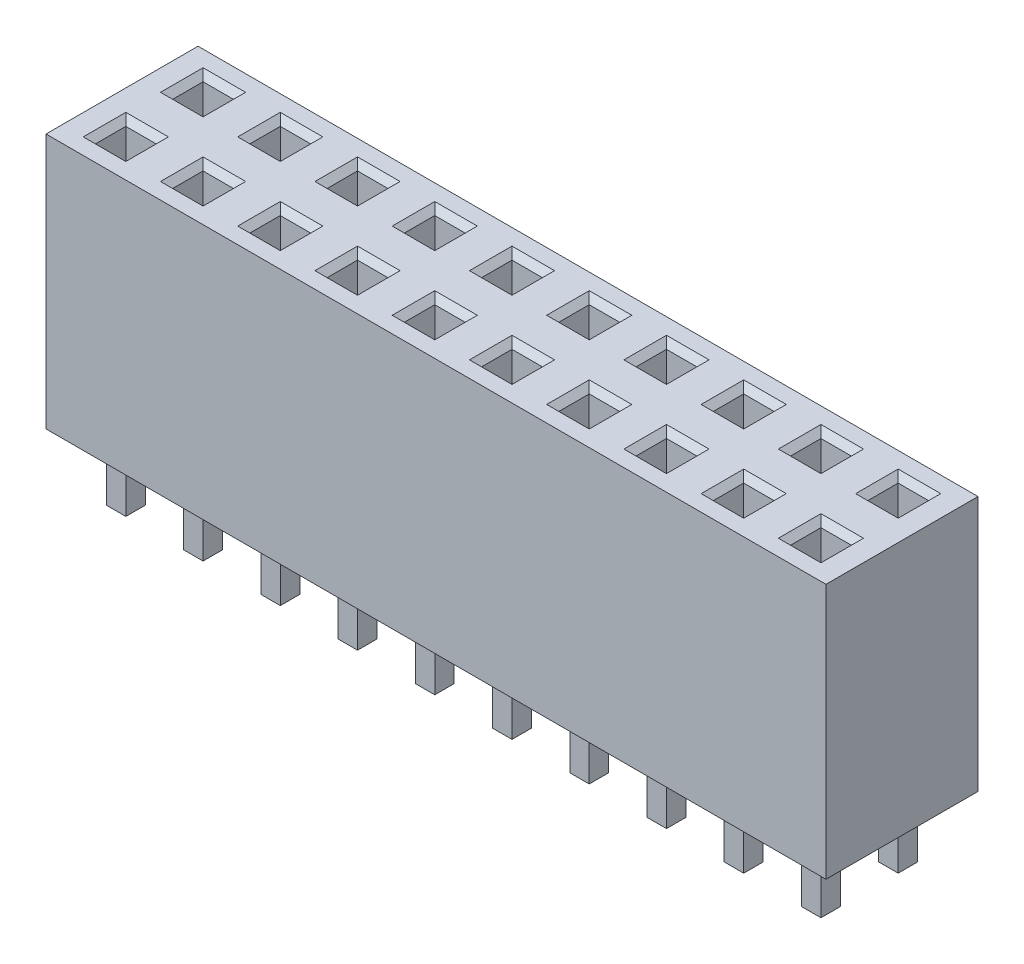
from build123d import *

# Parameters (mm, degrees)
SKETCH_1_W                         = 2.79
SKETCH_1_H                         = 5
EXTRUDE_1_DEPTH                    = 8.4
SKETCH_2_W                         = 1
SKETCH_2_H                         = 1
CUT_EXTRUDE_1_DEPTH                = 8
CHAMFER_1_SIZE                     = 0.2
SKETCH_3_W                         = 0.64
SKETCH_3_H                         = 0.64
EXTRUDE_2_DEPTH                    = 2.29
CHAMFER_2_SIZE                     = 0.2
PATTERN_LINEAR_1_COUNT             = 10
PATTERN_LINEAR_1_PITCH             = 2.54
CHAMFER_1_OF_PATTERN_LINEAR_1_SIZE = 0.2
CHAMFER_2_OF_PATTERN_LINEAR_1_SIZE = 0.2


with BuildPart() as part:
    # Эскиз1 → Бобышка-Вытянуть1 (new body)
    with BuildSketch(Plane(origin=(0, 0, 0), x_dir=(1, 0, 0), z_dir=(0, 1, 0))):
        Rectangle(SKETCH_1_W, SKETCH_1_H)
    extrude_1 = extrude(amount=EXTRUDE_1_DEPTH)

    # Эскиз2 → Вырез-Вытянуть1 (cut)
    with BuildSketch(Plane(origin=(0, 8.4, 0), x_dir=(1, 0, 0), z_dir=(0, 1, 0))):
        with Locations((0, 1.27)):
            Rectangle(SKETCH_2_W, SKETCH_2_H)
        with Locations((0, -1.27)):
            Rectangle(SKETCH_2_W, SKETCH_2_H)
    cut_extrude_1 = extrude(amount=-CUT_EXTRUDE_1_DEPTH, mode=Mode.SUBTRACT)

    # Фаска1
    chamfer_1_edges = [part.edges().sort_by_distance(p)[0] for p in [
        (0.5, 8.4, -1.27),
        (0, 8.4, -1.77),
        (-0.5, 8.4, -1.27),
        (0, 8.4, -0.77),
        (0, 8.4, 1.77),
        (0.5, 8.4, 1.27),
        (0, 8.4, 0.77),
        (-0.5, 8.4, 1.27),
    ]]
    chamfer(chamfer_1_edges, length=CHAMFER_1_SIZE)

    # Эскиз3 → Бобышка-Вытянуть2 (add)
    with BuildSketch(Plane(origin=(0, 0, 0), x_dir=(-1, 0, 0), z_dir=(0, -1, 0))):
        with Locations((0, 1.27)):
            Rectangle(SKETCH_3_W, SKETCH_3_H)
        with Locations((0, -1.27)):
            Rectangle(SKETCH_3_W, SKETCH_3_H)
    extrude_2 = extrude(amount=EXTRUDE_2_DEPTH)

    # Фаска2
    chamfer_2_edges = [part.edges().sort_by_distance(p)[0] for p in [
        (0.32, -2.29, -1.27),
        (0, -2.29, -0.95),
        (-0.32, -2.29, -1.27),
        (0, -2.29, -1.59),
        (-0.32, -2.29, 1.27),
        (0, -2.29, 0.95),
        (0.32, -2.29, 1.27),
        (0, -2.29, 1.59),
    ]]
    chamfer(chamfer_2_edges, length=CHAMFER_2_SIZE)

    # Линейный массив1: Бобышка-Вытянуть1, Вырез-Вытянуть1, Бобышка-Вытянуть2 ×10
    with Locations(*[(i * PATTERN_LINEAR_1_PITCH, 0, 0) for i in range(1, PATTERN_LINEAR_1_COUNT)]):
        add(extrude_1)
        add(cut_extrude_1, mode=Mode.SUBTRACT)
        add(extrude_2)

    # Фаска1 of Линейный массив1
    chamfer_1_of_pattern_linear_1_edges = [part.edges().sort_by_distance(p)[0] for p in [
        (3.04, 8.4, -1.27),
        (2.54, 8.4, -1.77),
        (2.04, 8.4, -1.27),
        (2.54, 8.4, -0.77),
        (2.54, 8.4, 1.77),
        (3.04, 8.4, 1.27),
        (2.54, 8.4, 0.77),
        (2.04, 8.4, 1.27),
        (5.58, 8.4, -1.27),
        (5.08, 8.4, -1.77),
        (4.58, 8.4, -1.27),
        (5.08, 8.4, -0.77),
        (5.08, 8.4, 1.77),
        (5.58, 8.4, 1.27),
        (5.08, 8.4, 0.77),
        (4.58, 8.4, 1.27),
        (8.12, 8.4, -1.27),
        (7.62, 8.4, -1.77),
        (7.12, 8.4, -1.27),
        (7.62, 8.4, -0.77),
        (7.62, 8.4, 1.77),
        (8.12, 8.4, 1.27),
        (7.62, 8.4, 0.77),
        (7.12, 8.4, 1.27),
        (10.66, 8.4, -1.27),
        (10.16, 8.4, -1.77),
        (9.66, 8.4, -1.27),
        (10.16, 8.4, -0.77),
        (10.16, 8.4, 1.77),
        (10.66, 8.4, 1.27),
        (10.16, 8.4, 0.77),
        (9.66, 8.4, 1.27),
        (13.2, 8.4, -1.27),
        (12.7, 8.4, -1.77),
        (12.2, 8.4, -1.27),
        (12.7, 8.4, -0.77),
        (12.7, 8.4, 1.77),
        (13.2, 8.4, 1.27),
        (12.7, 8.4, 0.77),
        (12.2, 8.4, 1.27),
        (15.74, 8.4, -1.27),
        (15.24, 8.4, -1.77),
        (14.74, 8.4, -1.27),
        (15.24, 8.4, -0.77),
        (15.24, 8.4, 1.77),
        (15.74, 8.4, 1.27),
        (15.24, 8.4, 0.77),
        (14.74, 8.4, 1.27),
        (18.28, 8.4, -1.27),
        (17.78, 8.4, -1.77),
        (17.28, 8.4, -1.27),
        (17.78, 8.4, -0.77),
        (17.78, 8.4, 1.77),
        (18.28, 8.4, 1.27),
        (17.78, 8.4, 0.77),
        (17.28, 8.4, 1.27),
        (20.82, 8.4, -1.27),
        (20.32, 8.4, -1.77),
        (19.82, 8.4, -1.27),
        (20.32, 8.4, -0.77),
        (20.32, 8.4, 1.77),
        (20.82, 8.4, 1.27),
        (20.32, 8.4, 0.77),
        (19.82, 8.4, 1.27),
        (23.36, 8.4, -1.27),
        (22.86, 8.4, -1.77),
        (22.36, 8.4, -1.27),
        (22.86, 8.4, -0.77),
        (22.86, 8.4, 1.77),
        (23.36, 8.4, 1.27),
        (22.86, 8.4, 0.77),
        (22.36, 8.4, 1.27),
    ]]
    chamfer(chamfer_1_of_pattern_linear_1_edges, length=CHAMFER_1_OF_PATTERN_LINEAR_1_SIZE)

    # Фаска2 of Линейный массив1
    chamfer_2_of_pattern_linear_1_edges = [part.edges().sort_by_distance(p)[0] for p in [
        (2.86, -2.29, -1.27),
        (2.54, -2.29, -0.95),
        (2.22, -2.29, -1.27),
        (2.54, -2.29, -1.59),
        (2.22, -2.29, 1.27),
        (2.54, -2.29, 0.95),
        (2.86, -2.29, 1.27),
        (2.54, -2.29, 1.59),
        (5.4, -2.29, -1.27),
        (5.08, -2.29, -0.95),
        (4.76, -2.29, -1.27),
        (5.08, -2.29, -1.59),
        (4.76, -2.29, 1.27),
        (5.08, -2.29, 0.95),
        (5.4, -2.29, 1.27),
        (5.08, -2.29, 1.59),
        (7.94, -2.29, -1.27),
        (7.62, -2.29, -0.95),
        (7.3, -2.29, -1.27),
        (7.62, -2.29, -1.59),
        (7.3, -2.29, 1.27),
        (7.62, -2.29, 0.95),
        (7.94, -2.29, 1.27),
        (7.62, -2.29, 1.59),
        (10.48, -2.29, -1.27),
        (10.16, -2.29, -0.95),
        (9.84, -2.29, -1.27),
        (10.16, -2.29, -1.59),
        (9.84, -2.29, 1.27),
        (10.16, -2.29, 0.95),
        (10.48, -2.29, 1.27),
        (10.16, -2.29, 1.59),
        (13.02, -2.29, -1.27),
        (12.7, -2.29, -0.95),
        (12.38, -2.29, -1.27),
        (12.7, -2.29, -1.59),
        (12.38, -2.29, 1.27),
        (12.7, -2.29, 0.95),
        (13.02, -2.29, 1.27),
        (12.7, -2.29, 1.59),
        (15.56, -2.29, -1.27),
        (15.24, -2.29, -0.95),
        (14.92, -2.29, -1.27),
        (15.24, -2.29, -1.59),
        (14.92, -2.29, 1.27),
        (15.24, -2.29, 0.95),
        (15.56, -2.29, 1.27),
        (15.24, -2.29, 1.59),
        (18.1, -2.29, -1.27),
        (17.78, -2.29, -0.95),
        (17.46, -2.29, -1.27),
        (17.78, -2.29, -1.59),
        (17.46, -2.29, 1.27),
        (17.78, -2.29, 0.95),
        (18.1, -2.29, 1.27),
        (17.78, -2.29, 1.59),
        (20.64, -2.29, -1.27),
        (20.32, -2.29, -0.95),
        (20, -2.29, -1.27),
        (20.32, -2.29, -1.59),
        (20, -2.29, 1.27),
        (20.32, -2.29, 0.95),
        (20.64, -2.29, 1.27),
        (20.32, -2.29, 1.59),
        (23.18, -2.29, -1.27),
        (22.86, -2.29, -0.95),
        (22.54, -2.29, -1.27),
        (22.86, -2.29, -1.59),
        (22.54, -2.29, 1.27),
        (22.86, -2.29, 0.95),
        (23.18, -2.29, 1.27),
        (22.86, -2.29, 1.59),
    ]]
    chamfer(chamfer_2_of_pattern_linear_1_edges, length=CHAMFER_2_OF_PATTERN_LINEAR_1_SIZE)


solid = part.part
